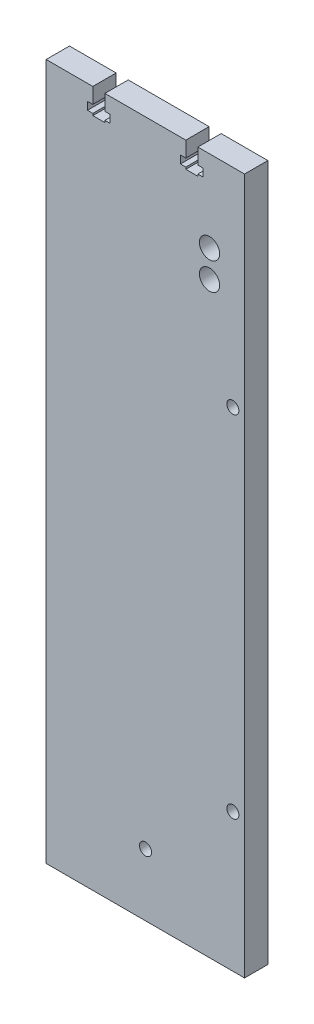
from build123d import *

# Parameters (mm, degrees)
SZKIC1_W                    = 51
SZKIC1_H                    = 179
DODANIE_WYCI_GNI_CIE1_DEPTH = 6
SZKIC3_R                    = 1.55
WYTNIJ_WYCI_GNI_CIE1_DEPTH  = 214.511356279
WYTNIJ_WYCI_GNI_CIE2_DEPTH  = 214.511356279
SZYK_LINIOWY1_COUNT         = 2
SZYK_LINIOWY1_PITCH         = 23.9
SZKIC5_R                    = 2.6
WYTNIJ_WYCI_GNI_CIE3_DEPTH  = 214.511356279
SZKIC7_R                    = 1.55
WYTNIJ_WYCI_GNI_CIE4_DEPTH  = 6


with BuildPart() as part:
    # Szkic1 → Dodanie-wyciągnięcie1 (new body)
    with BuildSketch(Plane.XY):
        with Locations((49.005699514, -110.5)):
            Rectangle(SZKIC1_W, SZKIC1_H)
    extrude(amount=-DODANIE_WYCI_GNI_CIE1_DEPTH)

    # Szkic3 → Wytnij-wyciągnięcie1 (cut, through all)
    with BuildSketch(Plane(origin=(0, 0, -6), x_dir=(-1, 0, 0), z_dir=(0, 0, -1))):
        with Locations((-71.505699514, -164.45)):
            Circle(SZKIC3_R)
        with Locations((-71.505699514, -74.45)):
            Circle(SZKIC3_R)
    extrude(amount=-WYTNIJ_WYCI_GNI_CIE1_DEPTH, mode=Mode.SUBTRACT)

    # Szkic4 → Wytnij-wyciągnięcie2 (cut, through all)
    with BuildSketch(Plane(origin=(0, 0, -6), x_dir=(-1, 0, 0), z_dir=(0, 0, -1))):
        Polygon((-59.405699514, -21), (-62.505699514, -21), (-62.505699514, -25), (-63.880699514, -25), (-63.880699514, -27), (-62.505699514, -27), (-62.505699514, -27.5), (-59.405699514, -27.5), (-59.405699514, -27), (-58.030699514, -27), (-58.030699514, -25), (-59.405699514, -25), align=None)
    wytnij_wyci_gni_cie2 = extrude(amount=-WYTNIJ_WYCI_GNI_CIE2_DEPTH, mode=Mode.SUBTRACT)

    # Szyk liniowy1: Wytnij-wyciągnięcie2 ×2
    with Locations(*[(-i * SZYK_LINIOWY1_PITCH, 0, 0) for i in range(1, SZYK_LINIOWY1_COUNT)]):
        add(wytnij_wyci_gni_cie2, mode=Mode.SUBTRACT)

    # Szkic5 → Wytnij-wyciągnięcie3 (cut, through all)
    with BuildSketch(Plane(origin=(0, 0, -6), x_dir=(-1, 0, 0), z_dir=(0, 0, -1))):
        with Locations((-65.505699514, -42)):
            Circle(SZKIC5_R)
        with Locations((-65.505699514, -49)):
            Circle(SZKIC5_R)
    extrude(amount=-WYTNIJ_WYCI_GNI_CIE3_DEPTH, mode=Mode.SUBTRACT)

    # Szkic7 → Wytnij-wyciągnięcie4 (cut)
    with BuildSketch(Plane(origin=(0, 0, -6), x_dir=(-1, 0, 0), z_dir=(0, 0, -1))):
        with Locations((-49.055699514, -184)):
            Circle(SZKIC7_R)
    extrude(amount=-WYTNIJ_WYCI_GNI_CIE4_DEPTH, mode=Mode.SUBTRACT)


solid = part.part
